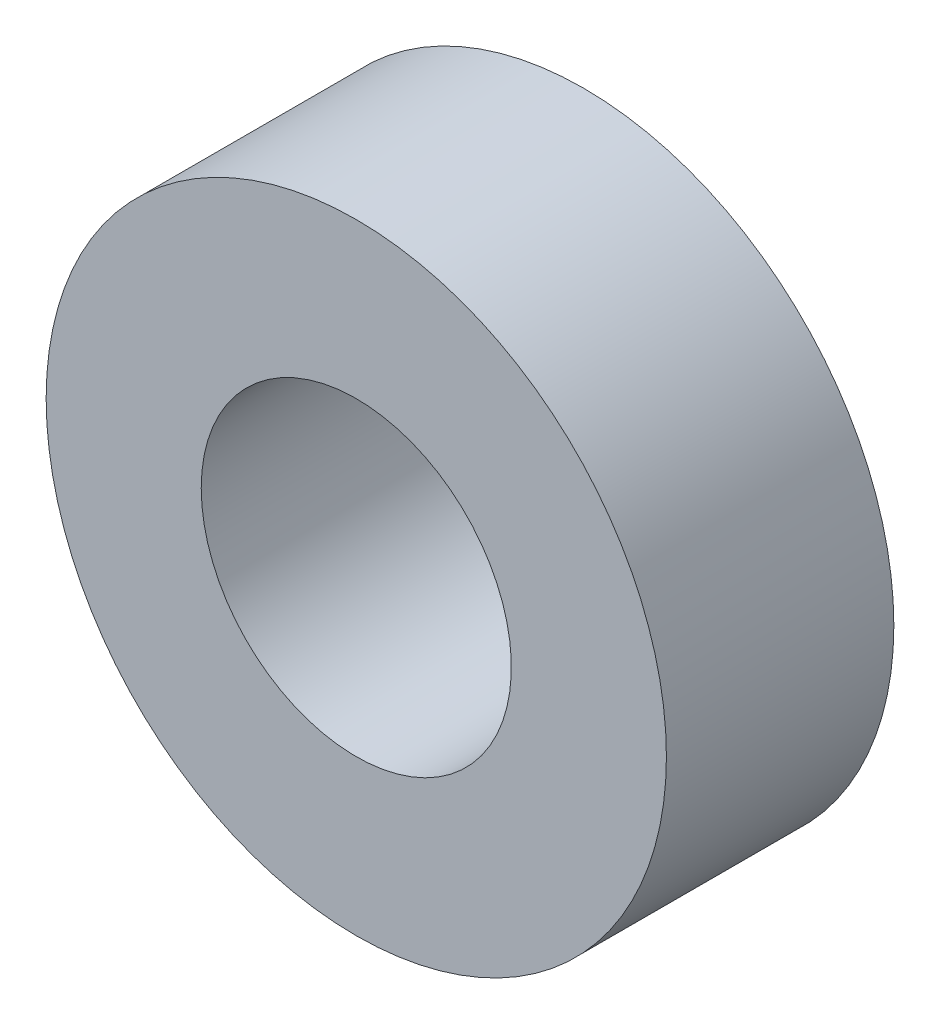
from build123d import *

# Parameters (mm, degrees)
SKETCH8_W = 9.525
SKETCH8_H = 13.97


with BuildPart() as part:
    # Sketch8 → Revolve3 (revolve)
    with BuildSketch(Plane(origin=(0, 0, 0), x_dir=(1, 0, 0), z_dir=(0, 1, 0))):
        with Locations((-14.2875, -6.985)):
            Rectangle(SKETCH8_W, SKETCH8_H)
    revolve(axis=Axis((0, 0, 0), (0, 0, 1)))


solid = part.part
